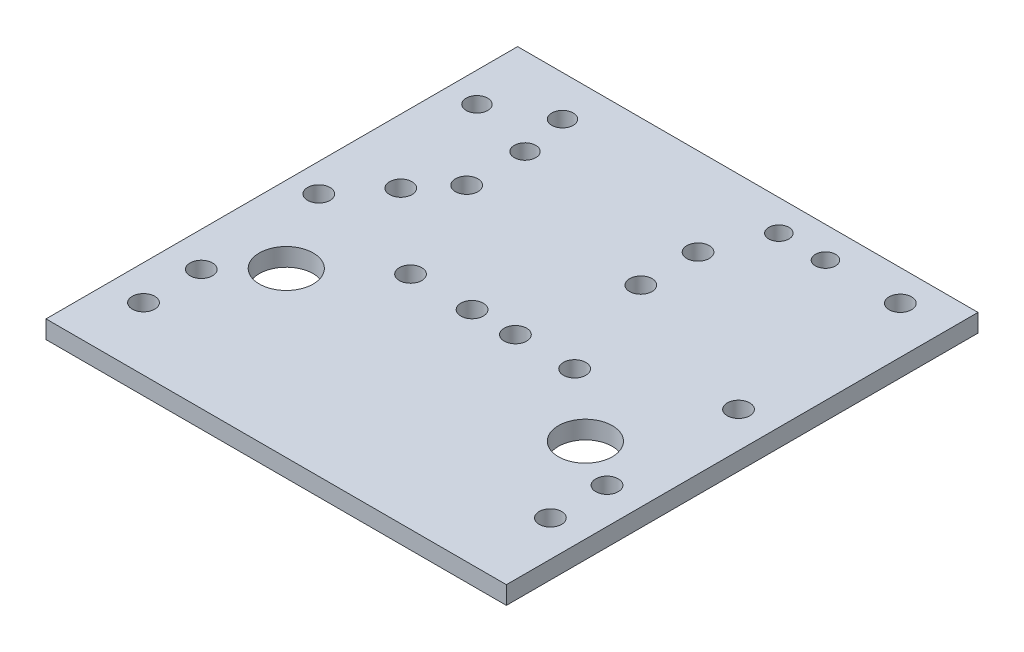
from build123d import *

# Parameters (mm, degrees)
ESBO_O1_W                = 20.5
ESBO_O1_H                = 21
RESSALTO_EXTRUS_O1_DEPTH = 0.8
ESBO_O2_R                = 0.5
ESBO_O2_R_2              = 1.2
ESBO_O2_R_3              = 0.45
ESBO_O2_R_4              = 0.478821701
CORTE_EXTRUS_O1_DEPTH    = 5


with BuildPart() as part:
    # Esboço1 → Ressalto-extrusão1 (new body)
    with BuildSketch(Plane(origin=(0, 0, 0), x_dir=(1, 0, 0), z_dir=(0, 1, 0))):
        Rectangle(ESBO_O1_W, ESBO_O1_H)
    extrude(amount=RESSALTO_EXTRUS_O1_DEPTH)

    # Esboço2 → Corte-extrusão1 (cut, symmetric)
    with BuildSketch(Plane(origin=(0, 0.8, 0), x_dir=(1, 0, 0), z_dir=(0, 1, 0))):
        with Locations(Location((8.169588965, 9.121369329, 0), (0, 0, 90))):
            Circle(ESBO_O2_R)
        with Locations(Location((8.656271278, 1.430267657, 0), (0, 0, 90))):
            Circle(ESBO_O2_R)
        with Locations(Location((8.656271278, -4.425515861, 0), (0, 0, 90))):
            Circle(ESBO_O2_R)
        with Locations(Location((8.656271278, -6.946579519, 0), (0, 0, 90))):
            Circle(ESBO_O2_R)
        with Locations(Location((6.475637733, -3.207774386, 0), (0, 0, 90))):
            Circle(ESBO_O2_R_2)
        with Locations(Location((-6.84447605, -3.207774386, 0), (0, 0, 90))):
            Circle(ESBO_O2_R_2)
        with Locations(Location((-8.701687341, -5.133968427, 0), (0, 0, 90))):
            Circle(ESBO_O2_R)
        with Locations(Location((-8.701687341, -7.706335777, 0), (0, 0, 90))):
            Circle(ESBO_O2_R)
        with Locations(Location((4.836575481, 9.121369329, 0), (0, 0, 90))):
            Circle(ESBO_O2_R_3)
        with Locations(Location((2.76166475, 9.121369329, 0), (0, 0, 90))):
            Circle(ESBO_O2_R_3)
        with Locations(Location((1.691416538, 6.593096738, 0), (0, 0, 90))):
            Circle(ESBO_O2_R)
        with Locations(Location((-8.994083212, 0.392498409, 0), (0, 0, 90))):
            Circle(ESBO_O2_R)
        with Locations(Location((-3.86010674, -0.657838238, 0), (0, 0, 90))):
            Circle(ESBO_O2_R)
        with Locations(Location((-1.120283175, -0.657838238, 0), (0, 0, 90))):
            Circle(ESBO_O2_R)
        with Locations(Location((0.809655437, -0.657838238, 0), (0, 0, 90))):
            Circle(ESBO_O2_R)
        with Locations(Location((3.446089433, -0.657838238, 0), (0, 0, 90))):
            Circle(ESBO_O2_R)
        with Locations(Location((1.691416538, 4.045324666, 0), (0, 0, 90))):
            Circle(ESBO_O2_R)
        with Locations(Location((-6.451906001, 8.700562352, 0), (0, 0, 90))):
            Circle(ESBO_O2_R_4)
        with Locations(Location((-6.038262859, 6.619037193, 0), (0, 0, 90))):
            Circle(ESBO_O2_R_4)
        with Locations(Location((-8.92956931, 7.368379214, 0), (0, 0, 90))):
            Circle(ESBO_O2_R_4)
        with Locations(Location((-6.038262859, 4.017675665, 0), (0, 0, 90))):
            Circle(ESBO_O2_R)
        with Locations(Location((-7.392078127, 2.439818031, 0), (0, 0, 90))):
            Circle(ESBO_O2_R)
    extrude(amount=CORTE_EXTRUS_O1_DEPTH, both=True, mode=Mode.SUBTRACT)


solid = part.part
